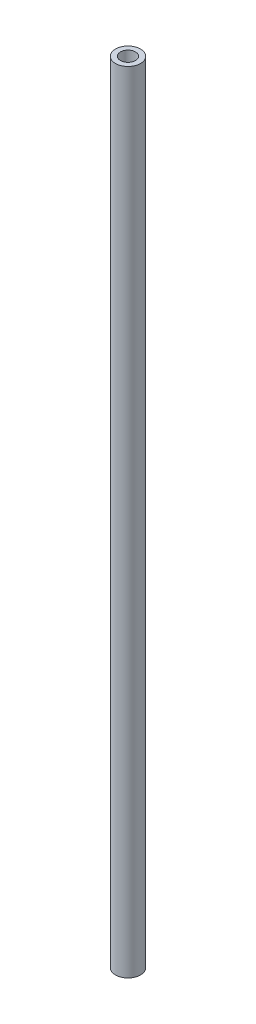
from build123d import *

# Parameters (mm, degrees)
SKETCH1_R           = 1.5875
SKETCH1_R_2         = 0.9525
BOSS_EXTRUDE1_DEPTH = 50


with BuildPart() as part:
    # Sketch1 → Boss-Extrude1 (new, symmetric)
    with BuildSketch(Plane(origin=(0, 0, 0), x_dir=(1, 0, 0), z_dir=(0, 1, 0))):
        with Locations(Location((0, 0, 0), (0, 0, 270))):
            Circle(SKETCH1_R)
        with Locations(Location((0, 0, 0), (0, 0, 270))):
            Circle(SKETCH1_R_2, mode=Mode.SUBTRACT)
    extrude(amount=BOSS_EXTRUDE1_DEPTH, both=True)


solid = part.part
